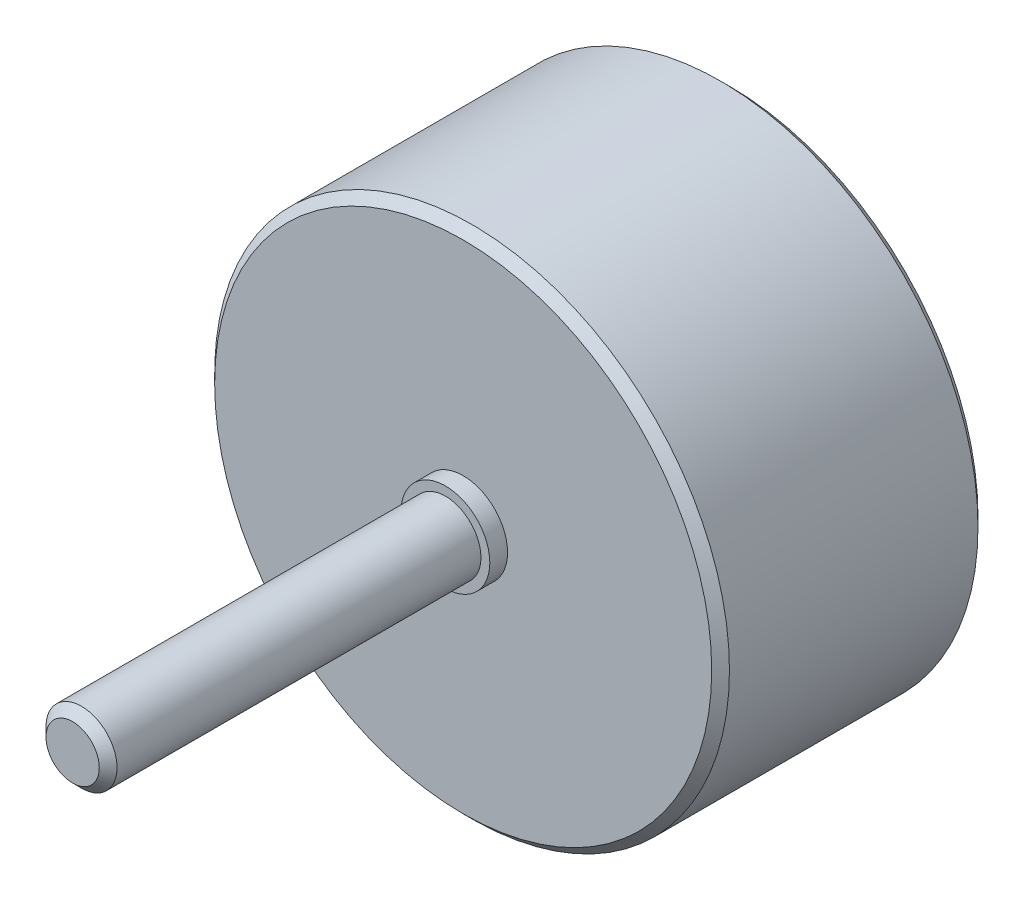
from build123d import *

# Parameters (mm, degrees)
ESQUISSE1_R             = 29
BOSS_EXTRU_1_DEPTH      = 30
ESQUISSE2_R             = 4
BOSS_EXTRU_2_DEPTH      = 6
ESQUISSE3_R             = 5
BOSS_EXTRU_3_DEPTH      = 2
ESQUISSE4_R             = 4
ENL_V_MAT_EXTRU_1_DEPTH = 5
CHANFREIN1_SIZE         = 1
ESQUISSE5_R             = 4
BOSS_EXTRU_4_DEPTH      = 10
ESQUISSE6_R             = 4
BOSS_EXTRU_5_DEPTH      = 28
CHANFREIN2_SIZE         = 1


with BuildPart() as part:
    # Esquisse1 → Boss.-Extru.1 (new body)
    with BuildSketch(Plane.XY):
        Circle(ESQUISSE1_R)
    extrude(amount=BOSS_EXTRU_1_DEPTH)

    # Esquisse2 → Boss.-Extru.2 (add)
    with BuildSketch(Plane.XY.offset(30)):
        Circle(ESQUISSE2_R)
    extrude(amount=BOSS_EXTRU_2_DEPTH)

    # Esquisse3 → Boss.-Extru.3 (add)
    with BuildSketch(Plane.XY.offset(30)):
        Circle(ESQUISSE3_R)
    extrude(amount=BOSS_EXTRU_3_DEPTH)

    # Esquisse4 → Enlèv. mat.-Extru.1 (cut)
    with BuildSketch(Plane(origin=(0, 0, 0), x_dir=(-1, 0, 0), z_dir=(0, 0, -1))):
        with Locations(Location((0, 0, 0), (0, 0, 180))):
            Circle(ESQUISSE4_R)
    extrude(amount=-ENL_V_MAT_EXTRU_1_DEPTH, mode=Mode.SUBTRACT)

    # Chanfrein1
    chanfrein1_edges = [part.edges().sort_by_distance(p)[0] for p in [
        (-29, 0, 0),
        (-29, 0, 30),
    ]]
    chamfer(chanfrein1_edges, length=CHANFREIN1_SIZE)

    # Esquisse5 → Boss.-Extru.4 (add)
    with BuildSketch(Plane.XY.offset(36)):
        Circle(ESQUISSE5_R)
    extrude(amount=BOSS_EXTRU_4_DEPTH)

    # Esquisse6 → Boss.-Extru.5 (add)
    with BuildSketch(Plane.XY.offset(46)):
        Circle(ESQUISSE6_R)
    extrude(amount=BOSS_EXTRU_5_DEPTH)

    # Chanfrein2
    chanfrein2_edges = [part.edges().sort_by_distance(p)[0] for p in [
        (-4, 0, 74),
    ]]
    chamfer(chanfrein2_edges, length=CHANFREIN2_SIZE)


solid = part.part
